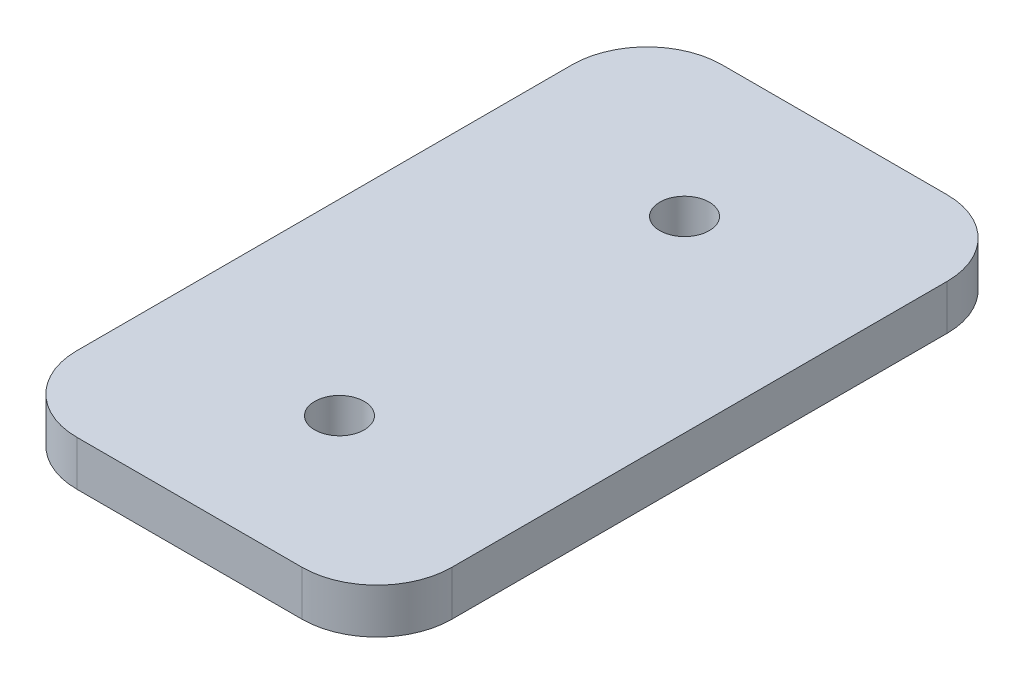
from build123d import *

# Parameters (mm, degrees)
BOSS_EXTRUDE1_DEPTH      = 40
BOSS_EXTRUDE1_DEPTH_BACK = 46
SKETCH1_W                = 50
SKETCH1_H                = 6
SKETCH2_R                = 3.3
CUT_EXTRUDE1_DEPTH       = 399.937404872
FILLET1_R                = 10


with BuildPart() as part:
    # Sketch1 → Boss-Extrude1 (new, two sides: drawn at the far end of the back side and taken through both)
    with BuildSketch(Plane.XY.offset(-BOSS_EXTRUDE1_DEPTH_BACK)):
        with Locations((371.231060123, 22)):
            Rectangle(SKETCH1_W, SKETCH1_H)
    extrude(amount=BOSS_EXTRUDE1_DEPTH + BOSS_EXTRUDE1_DEPTH_BACK)

    # Sketch2 → Cut-Extrude1 (cut, through all)
    with BuildSketch(Plane.XZ.offset(-19)):
        with Locations((371.231060123, -26)):
            Circle(SKETCH2_R)
        with Locations(Location((371.231060123, 20, 0), (0, 0, 180))):
            Circle(SKETCH2_R)
    extrude(amount=-CUT_EXTRUDE1_DEPTH, mode=Mode.SUBTRACT)

    # Fillet1
    fillet1_edges = [part.edges().sort_by_distance(p)[0] for p in [
        (396.231060123, 22, -46),
        (346.231060123, 22, 40),
        (396.231060123, 22, 40),
        (346.231060123, 22, -46),
    ]]
    fillet(fillet1_edges, radius=FILLET1_R)


solid = part.part
